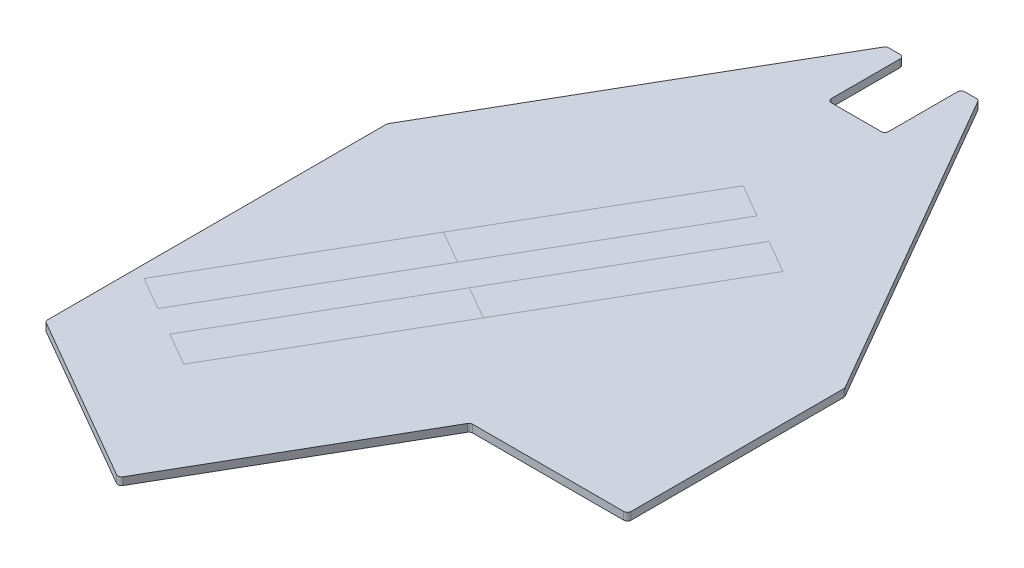
from build123d import *

# Parameters (mm, degrees)
BOSS_EXTRUDE2_DEPTH = 20


with BuildPart() as part:
    # Sketch1 → Boss-Extrude2 (new body)
    with BuildSketch(Plane(origin=(0, 0, 0), x_dir=(1, 0, 0), z_dir=(0, 1, 0))):
        with BuildLine():
            Line((590, 0), (194.448637287, 0))
            ThreePointArc((194.448637287, 0), (189.448637287, -1.339745962), (185.788383249, -5))
            Line((185.788383249, -5), (-144.675037911, -577.379435493))
            ThreePointArc((-144.675037911, -577.379435493), (-150.747101498, -582.038693755), (-158.335291949, -581.03968953))
            Line((-158.335291949, -581.03968953), (-595, -328.931202792))
            ThreePointArc((-595, -328.931202792), (-598.660254038, -325.270948754), (-600, -320.270948754))
            Line((-600, -320.270948754), (-600, 0))
            Line((-600, 0), (-600, 567.320508076))
            ThreePointArc((-600, 567.320508076), (-599.659258263, 569.908698527), (-598.660254038, 572.320508076))
            Line((-598.660254038, 572.320508076), (-123.686027919, 1395))
            ThreePointArc((-123.686027919, 1395), (-120.025773881, 1398.660254038), (-115.025773881, 1400))
            Line((-115.025773881, 1400), (-85, 1400))
            ThreePointArc((-85, 1400), (-77.928932188, 1397.071067812), (-75, 1390))
            Line((-75, 1390), (-75, 1210))
            ThreePointArc((-75, 1210), (-72.071067812, 1202.928932188), (-65, 1200))
            Line((-65, 1200), (65, 1200))
            ThreePointArc((65, 1200), (72.071067812, 1202.928932188), (75, 1210))
            Line((75, 1210), (75, 1390))
            ThreePointArc((75, 1390), (77.928932188, 1397.071067812), (85, 1400))
            Line((85, 1400), (115.025773881, 1400))
            ThreePointArc((115.025773881, 1400), (120.025773881, 1398.660254038), (123.686027919, 1395))
            Line((123.686027919, 1395), (598.660254038, 572.320508076))
            ThreePointArc((598.660254038, 572.320508076), (599.659258263, 569.908698527), (600, 567.320508076))
            Line((600, 567.320508076), (600, 10))
            ThreePointArc((600, 10), (597.071067812, 2.928932188), (590, 0))
        make_face()
    extrude(amount=BOSS_EXTRUDE2_DEPTH)


solid = part.part
